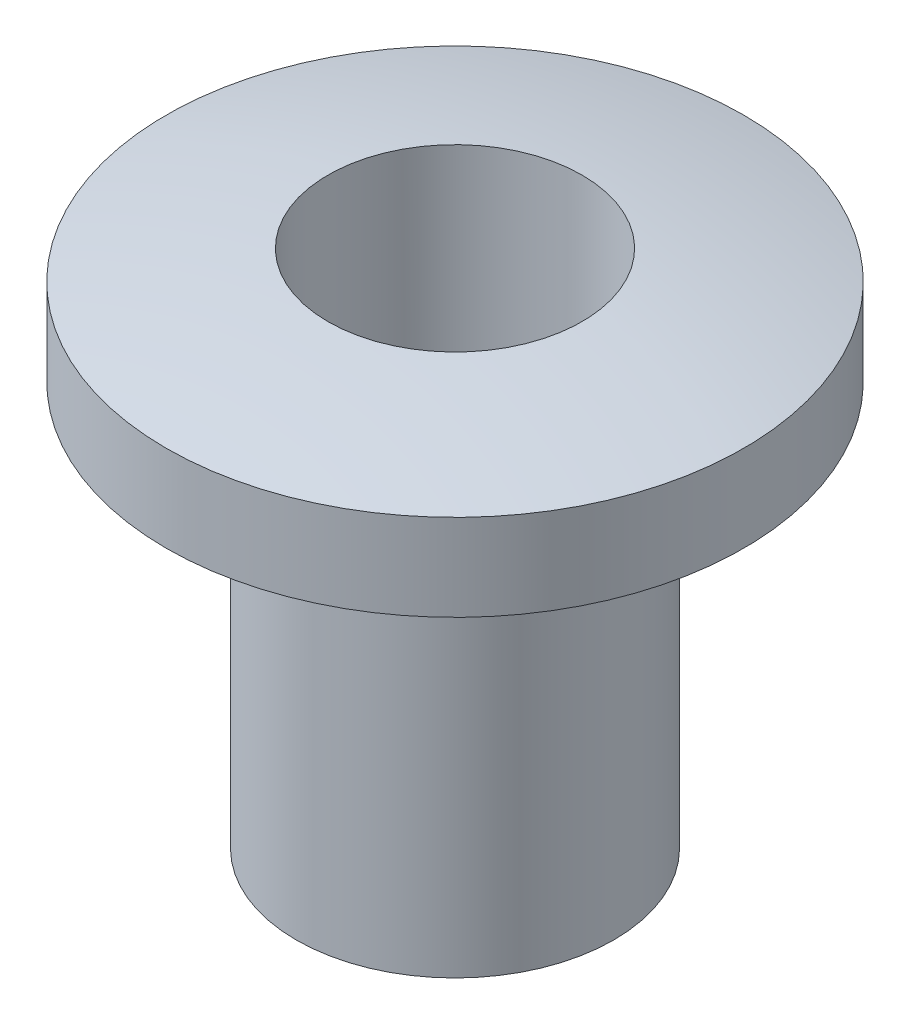
from build123d import *


with BuildPart() as part:
    # Sketch1 → Revolve1 (revolve)
    with BuildSketch(Plane(origin=(0, 0, 0), x_dir=(0, 0, -1), z_dir=(1, 0, 0)), mode=Mode.PRIVATE) as revolve1_sk:
        with BuildLine():
            Line((2.2, 0), (2.2, 9))
            ThreePointArc((2.2, 9), (3.608670115, 8.798552645), (5, 8.5))
            Line((5, 8.5), (5, 7))
            Line((5, 7), (2.75, 7))
            Line((2.75, 7), (2.75, 0))
            Line((2.75, 0), (2.2, 0))
        make_face()
    revolve(revolve1_sk.sketch.rotate(Axis((0, 14.150537634, 0), (0, -1, 0)), 180), axis=Axis((0, 14.150537634, 0), (0, -1, 0)))


solid = part.part
